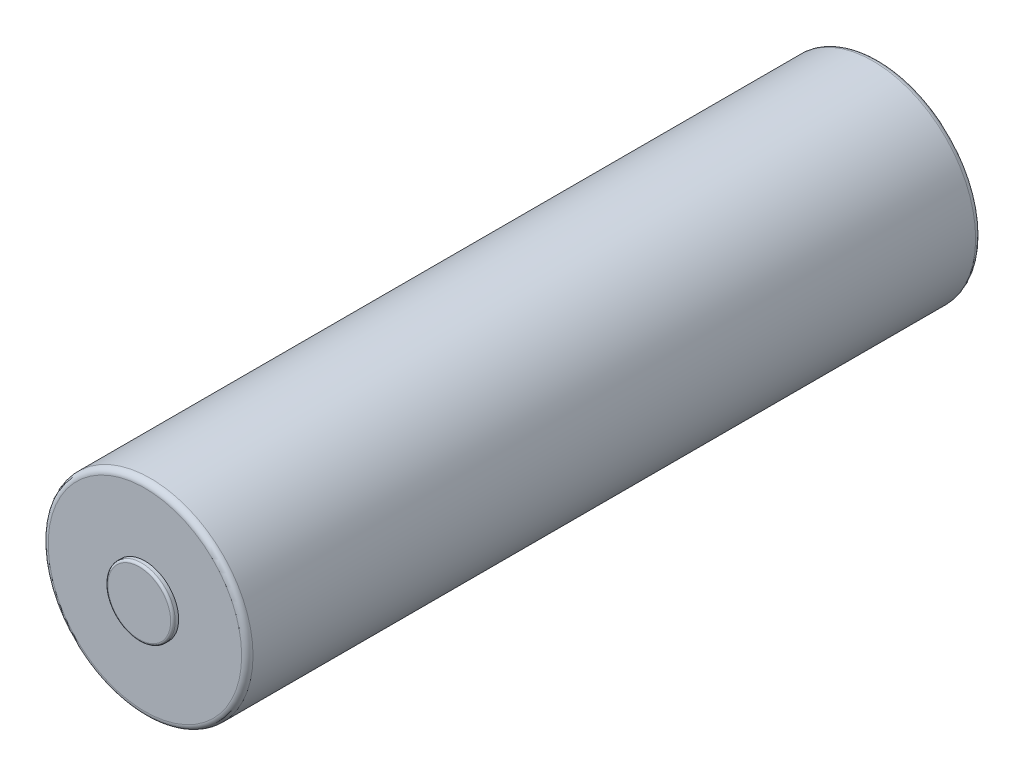
from build123d import *

# Parameters (mm, degrees)
SKETCH1_R           = 9
BOSS_EXTRUDE1_DEPTH = 64.5
FILLET1_R           = 0.5
SKETCH2_R           = 2.962162188
BOSS_EXTRUDE2_DEPTH = 0.5
FILLET2_R           = 0.2


with BuildPart() as part:
    # Sketch1 → Boss-Extrude1 (new body)
    with BuildSketch(Plane.XY):
        Circle(SKETCH1_R)
    extrude(amount=BOSS_EXTRUDE1_DEPTH)

    # Fillet1
    fillet1_edges = [part.edges().sort_by_distance(p)[0] for p in [
        (-9, 0, 0),
        (-9, 0, 64.5),
    ]]
    fillet(fillet1_edges, radius=FILLET1_R)

    # Sketch2 → Boss-Extrude2 (add)
    with BuildSketch(Plane.XY.offset(64.5)):
        Circle(SKETCH2_R)
    extrude(amount=BOSS_EXTRUDE2_DEPTH)

    # Fillet2
    fillet2_edges = [part.edges().sort_by_distance(p)[0] for p in [
        (-2.962162188, 0, 65),
    ]]
    fillet(fillet2_edges, radius=FILLET2_R)


solid = part.part
